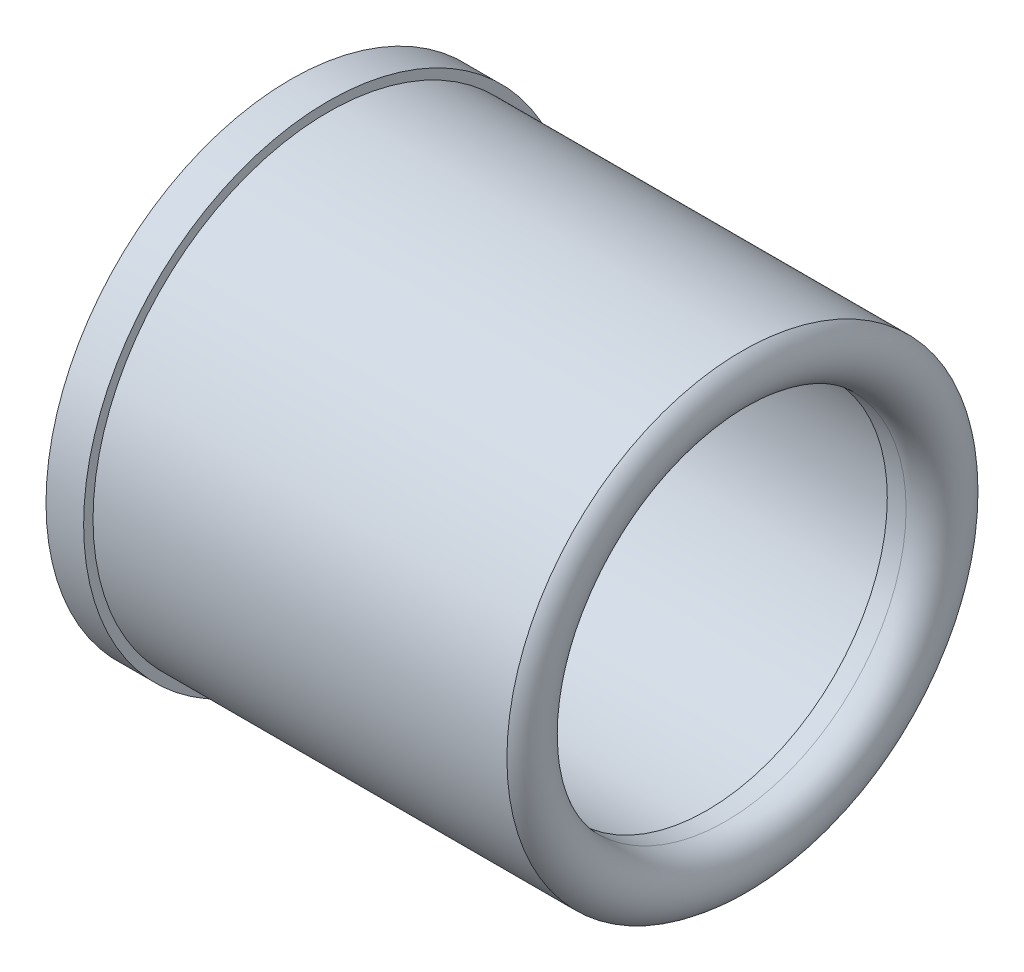
from build123d import *


with BuildPart() as part:
    # Sketch1 → Revolve1 (revolve)
    with BuildSketch(Plane(origin=(0, 0, 0), x_dir=(-1, 0, 0), z_dir=(0, 0, -1)), mode=Mode.PRIVATE) as revolve1_sk:
        with BuildLine():
            Line((-11.972812665, -3.733263235), (-11.972812665, -3.483263235))
            Line((-11.972812665, -3.483263235), (-0.912123334, -3.483263235))
            Line((-0.912123334, -3.483263235), (-0.912123334, -2.033263235))
            Line((-0.912123334, -2.033263235), (-1.912123334, -2.033263235))
            Line((-1.912123334, -2.033263235), (-1.912123334, -2.283263235))
            Line((-1.912123334, -2.283263235), (-12.912123334, -2.283263235))
            ThreePointArc((-12.912123334, -2.283263235), (-13.230357031, -3.171229021), (-12.472812665, -3.733263235))
            Line((-12.472812665, -3.733263235), (-11.972812665, -3.733263235))
        make_face()
    revolve(revolve1_sk.sketch.rotate(Axis((12.175741694, -8.533263235, 0), (-1, 0, 0)), 270), axis=Axis((12.175741694, -8.533263235, 0), (-1, 0, 0)))


solid = part.part
